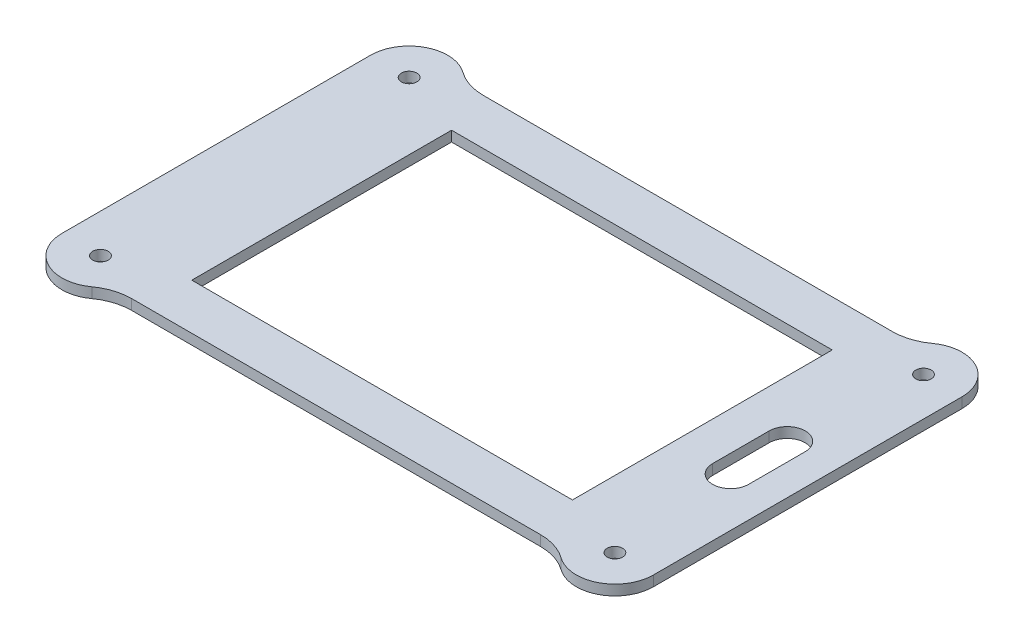
from build123d import *

# Parameters (mm, degrees)
SKETCH2_R           = 1.5
SKETCH2_W           = 74
SKETCH2_H           = 50.5
BOSS_EXTRUDE1_DEPTH = 2
SKETCH4_W           = 6
SKETCH4_H           = 60
BOSS_EXTRUDE3_DEPTH = 2
FILLET1_R           = 10


with BuildPart() as part:
    # Sketch2 → Boss-Extrude1 (new body)
    with BuildSketch(Plane(origin=(0, 0, 0), x_dir=(1, 0, 0), z_dir=(0, 1, 0))):
        with BuildLine():
            Line((-43.782705459, 34.194669068), (43.782705459, 34.194669068))
            ThreePointArc((43.782705459, 34.194669068), (55.303300859, 35.303300859), (54.194669068, 23.782705459))
            Line((54.194669068, 23.782705459), (54.194669068, -23.782705459))
            ThreePointArc((54.194669068, -23.782705459), (55.303300859, -35.303300859), (43.782705459, -34.194669068))
            Line((43.782705459, -34.194669068), (-43.782705459, -34.194669068))
            ThreePointArc((-43.782705459, -34.194669068), (-55.303300859, -35.303300859), (-54.194669068, -23.782705459))
            Line((-54.194669068, -23.782705459), (-54.194669068, 23.782705459))
            ThreePointArc((-54.194669068, 23.782705459), (-55.303300859, 35.303300859), (-43.782705459, 34.194669068))
        make_face()
        with Locations(Location((-50, -30, 0), (0, 0, 270))):
            Circle(SKETCH2_R, mode=Mode.SUBTRACT)
        with Locations(Location((50, -30, 0), (0, 0, 270))):
            Circle(SKETCH2_R, mode=Mode.SUBTRACT)
        with Locations(Location((-50, 30, 0), (0, 0, 270))):
            Circle(SKETCH2_R, mode=Mode.SUBTRACT)
        with Locations(Location((50, 30, 0), (0, 0, 270))):
            Circle(SKETCH2_R, mode=Mode.SUBTRACT)
        Rectangle(SKETCH2_W, SKETCH2_H, mode=Mode.SUBTRACT)
        with BuildLine():
            Line((51.5, 5.5), (51.5, -5.5))
            ThreePointArc((51.5, -5.5), (48, -9), (44.5, -5.5))
            Line((44.5, -5.5), (44.5, 5.5))
            ThreePointArc((44.5, 5.5), (48, 9), (51.5, 5.5))
        make_face(mode=Mode.SUBTRACT)
    extrude(amount=BOSS_EXTRUDE1_DEPTH)

    # Sketch4 → Boss-Extrude3 (add, through all)
    with BuildSketch(Plane(origin=(0, 2, 0), x_dir=(1, 0, 0), z_dir=(0, 1, 0))):
        with Locations((54.5, 0)):
            Rectangle(SKETCH4_W, SKETCH4_H)
    boss_extrude3 = extrude(amount=-BOSS_EXTRUDE3_DEPTH)

    # Mirror1: Boss-Extrude3 across plane
    add(boss_extrude3.mirror(Plane(origin=(0, 0, 0), x_dir=(0, 0, 1), z_dir=(1, 0, 0))))

    # Fillet1
    fillet1_edges = [part.edges().sort_by_distance(p)[0] for p in [
        (-43.782705459, 1, -34.194669068),
        (43.782705459, 1, -34.194669068),
        (43.782705459, 1, 34.194669068),
        (-43.782705459, 1, 34.194669068),
    ]]
    fillet(fillet1_edges, radius=FILLET1_R)


solid = part.part
